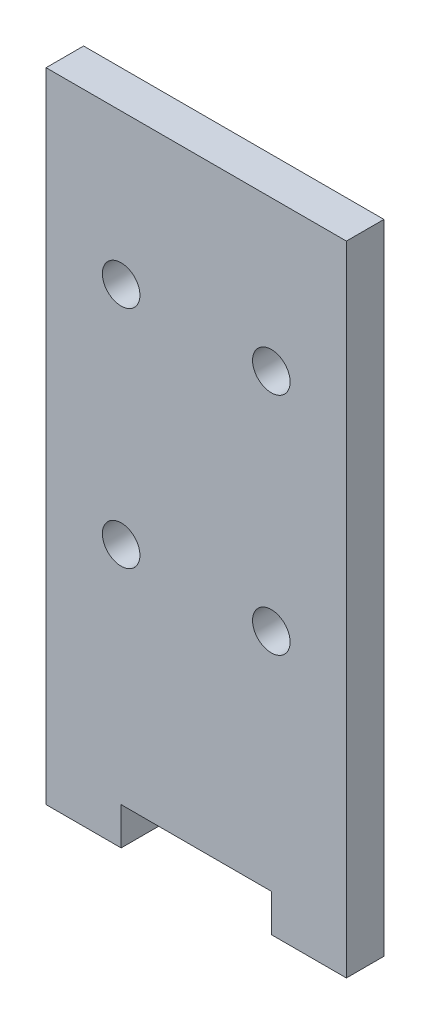
from build123d import *

# Parameters (mm, degrees)
SKETCH1_R           = 3.175
BOSS_EXTRUDE1_DEPTH = 6.35


with BuildPart() as part:
    # Sketch1 → Boss-Extrude1 (new body)
    with BuildSketch(Plane.XY):
        Polygon((12.7, 0), (38.1, 0), (38.1, -6.35), (50.8, -6.35), (50.8, 0), (50.8, 101.6), (0, 101.6), (0, 0), (0, -6.35), (12.7, -6.35), align=None)
        with Locations((12.7, 76.2)):
            Circle(SKETCH1_R, mode=Mode.SUBTRACT)
        with Locations(Location((38.1, 76.2, 0), (0, 0, 180))):
            Circle(SKETCH1_R, mode=Mode.SUBTRACT)
        with Locations((12.7, 38.1)):
            Circle(SKETCH1_R, mode=Mode.SUBTRACT)
        with Locations(Location((38.1, 38.1, 0), (0, 0, 180))):
            Circle(SKETCH1_R, mode=Mode.SUBTRACT)
    extrude(amount=BOSS_EXTRUDE1_DEPTH)


solid = part.part
